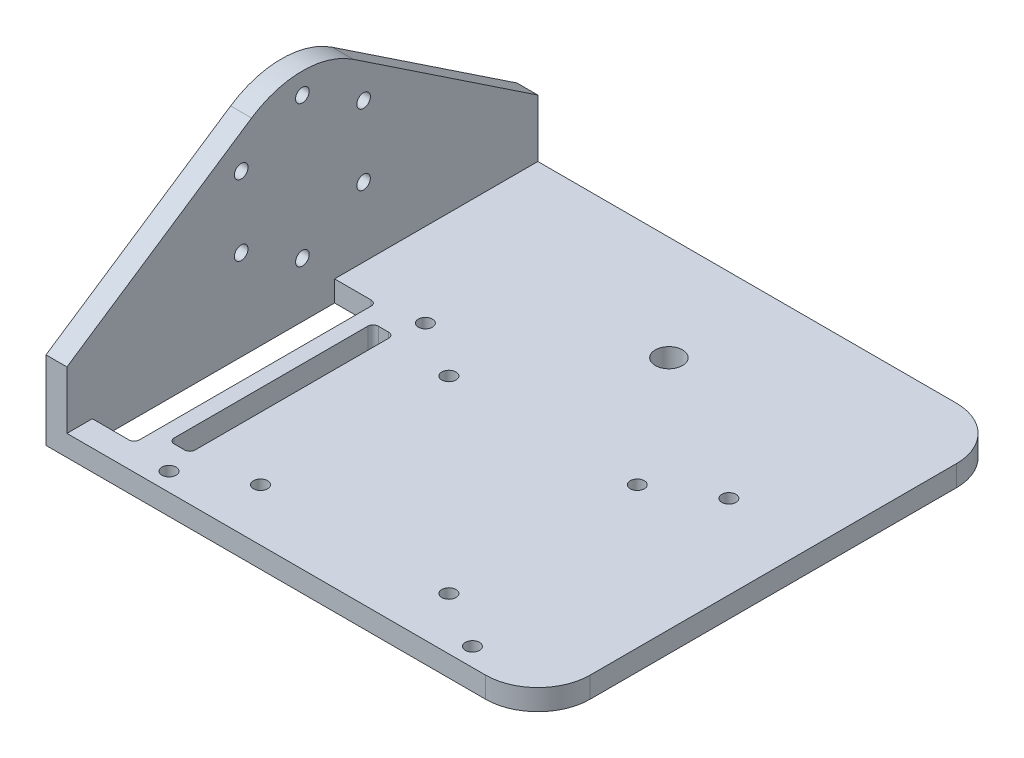
from build123d import *

# Parameters (mm, degrees)
SKETCH_3_W          = 90
SKETCH_3_H          = 90
EXTRUDE_3_DEPTH     = 4
EXTRUDE_4_DEPTH     = 4
SKETCH_5_R          = 1.3
CUT_EXTRUDE_1_DEPTH = 4
SKETCH_6_R          = 2.6
SKETCH_6_R_2        = 1.35
CUT_EXTRUDE_2_DEPTH = 4
SKETCH_7_W          = 4
SKETCH_7_H          = 39
SKETCH_7_W_2        = 8
SKETCH_7_H_2        = 46.3
CUT_EXTRUDE_3_DEPTH = 4
FILLET_3_R          = 1
FILLET_4_R          = 10


with BuildPart() as part:
    # 草图3 → 凸台-拉伸3 (new body)
    with BuildSketch(Plane(origin=(0, 0, 0), x_dir=(1, 0, 0), z_dir=(0, 1, 0))):
        Rectangle(SKETCH_3_W, SKETCH_3_H)
    extrude(amount=EXTRUDE_3_DEPTH)

    # 草图4 → 凸台-拉伸4 (add)
    with BuildSketch(Plane.ZY.offset(45)):
        with BuildLine():
            Line((-45, 4), (-45, 15))
            Line((-45, 15), (-9.716498114, 38.55471279))
            ThreePointArc((-9.716498114, 38.55471279), (0, 41.5), (9.716498114, 38.55471279))
            Line((9.716498114, 38.55471279), (45, 15))
            Line((45, 15), (45, 4))
            Line((45, 4), (45, 0))
            Line((45, 0), (-45, 0))
            Line((-45, 0), (-45, 4))
        make_face()
    extrude(amount=EXTRUDE_4_DEPTH)

    # 草图5 → 切除-拉伸1 (cut)
    with BuildSketch(Plane(origin=(-45, 0, 0), x_dir=(0, 0, -1), z_dir=(1, 0, 0))):
        with Locations((0, 37.5)):
            Circle(SKETCH_5_R)
        with Locations((11.691342951, 30.75)):
            Circle(SKETCH_5_R)
        with Locations((11.691342951, 17.25)):
            Circle(SKETCH_5_R)
        with Locations((0, 10.5)):
            Circle(SKETCH_5_R)
        with Locations((-11.691342951, 17.25)):
            Circle(SKETCH_5_R)
        with Locations((-11.691342951, 30.75)):
            Circle(SKETCH_5_R)
    extrude(amount=-CUT_EXTRUDE_1_DEPTH, mode=Mode.SUBTRACT)

    # 草图6 → 切除-拉伸2 (cut)
    with BuildSketch(Plane(origin=(0, 4, 0), x_dir=(1, 0, 0), z_dir=(0, 1, 0))):
        with Locations(Location((0, 25.05, 0), (0, 0, 270))):
            Circle(SKETCH_6_R)
        with Locations(Location((-29, -41.5, 0), (0, 0, 270))):
            Circle(SKETCH_6_R_2)
        with Locations(Location((-29, 7.5, 0), (0, 0, 270))):
            Circle(SKETCH_6_R_2)
        with Locations(Location((-18, -35, 0), (0, 0, 270))):
            Circle(SKETCH_6_R_2)
        with Locations(Location((-18, 1, 0), (0, 0, 270))):
            Circle(SKETCH_6_R_2)
        with Locations(Location((29, -41.5, 0), (0, 0, 90))):
            Circle(SKETCH_6_R_2)
        with Locations(Location((18, -35, 0), (0, 0, 90))):
            Circle(SKETCH_6_R_2)
        with Locations(Location((18, 1, 0), (0, 0, 90))):
            Circle(SKETCH_6_R_2)
        with Locations(Location((29, 7.5, 0), (0, 0, 90))):
            Circle(SKETCH_6_R_2)
    extrude(amount=-CUT_EXTRUDE_2_DEPTH, mode=Mode.SUBTRACT)

    # 草图7 → 切除-拉伸3 (cut)
    with BuildSketch(Plane(origin=(0, 4, 0), x_dir=(1, 0, 0), z_dir=(0, 1, 0))):
        with Locations((-32, -17)):
            Rectangle(SKETCH_7_W, SKETCH_7_H)
        with Locations((-41, -17)):
            Rectangle(SKETCH_7_W_2, SKETCH_7_H_2)
    extrude(amount=-CUT_EXTRUDE_3_DEPTH, mode=Mode.SUBTRACT)

    # 圆角3
    fillet_3_edges = [part.edges().sort_by_distance(p)[0] for p in [
        (-37, 2, 40.15),
        (-37, 2, -6.15),
        (-30, 2, 36.5),
        (-30, 2, -2.5),
        (-34, 2, -2.5),
        (-34, 2, 36.5),
    ]]
    fillet(fillet_3_edges, radius=FILLET_3_R)

    # 圆角4
    fillet_4_edges = [part.edges().sort_by_distance(p)[0] for p in [
        (45, 2, 45),
        (45, 2, -45),
    ]]
    fillet(fillet_4_edges, radius=FILLET_4_R)


solid = part.part
